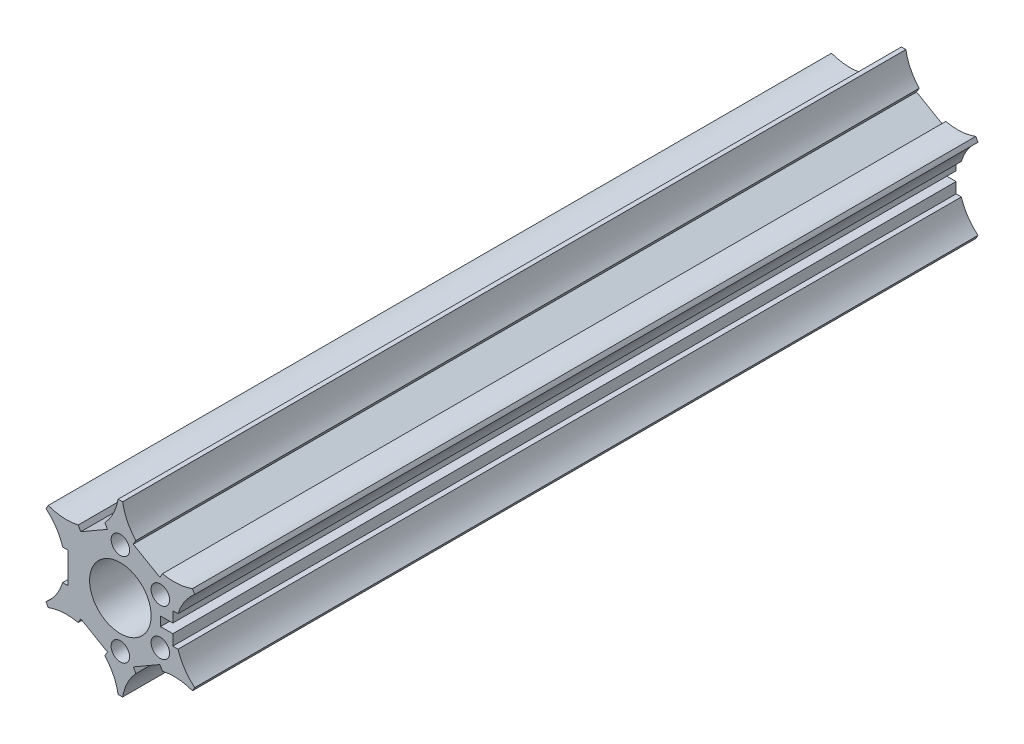
from build123d import *

# Parameters (mm, degrees)
BOSS_EXTRU_1_DEPTH      = 254.666666667
ESQUISSE4_R             = 51.382798763
ESQUISSE4_R_2           = 27.5
ENL_V_MAT_EXTRU_1_DEPTH = 265.098930571
ESQUISSE5_R             = 10
ESQUISSE5_R_2           = 3
ESQUISSE5_W             = 1.7
ESQUISSE5_H             = 10
ENL_V_MAT_EXTRU_2_DEPTH = 258.285428534


with BuildPart() as part:
    # Esquisse1 → Boss.-Extru.1 (new body)
    with BuildSketch(Plane.XY):
        with BuildLine():
            Line((-17.5, -48.310889132), (-17.5, -47.310889132))
            ThreePointArc((-17.5, -47.310889132), (-9, -15.588457268), (-32.222431864, -38.810889132))
            Line((-32.222431864, -38.810889132), (-33.088457268, -39.310889132))
            ThreePointArc((-33.088457268, -39.310889132), (-35.314540075, -27.733649929), (-29.89862988, -17.26198201))
            ThreePointArc((-29.89862988, -17.26198201), (-41.675315415, -16.716463864), (-50.588457268, -9))
            Line((-50.588457268, -9), (-49.722431864, -8.5))
            ThreePointArc((-49.722431864, -8.5), (-18, 0), (-49.722431864, 8.5))
            Line((-49.722431864, 8.5), (-50.588457268, 9))
            ThreePointArc((-50.588457268, 9), (-41.675315415, 16.716463864), (-29.89862988, 17.26198201))
            ThreePointArc((-29.89862988, 17.26198201), (-35.314540075, 27.733649929), (-33.088457268, 39.310889132))
            Line((-33.088457268, 39.310889132), (-32.222431864, 38.810889132))
            ThreePointArc((-32.222431864, 38.810889132), (-9, 15.588457268), (-17.5, 47.310889132))
            Line((-17.5, 47.310889132), (-17.5, 48.310889132))
            ThreePointArc((-17.5, 48.310889132), (-6.36077534, 44.450113792), (0, 34.523964019))
            ThreePointArc((0, 34.523964019), (6.36077534, 44.450113792), (17.5, 48.310889132))
            Line((17.5, 48.310889132), (17.5, 47.310889132))
            ThreePointArc((17.5, 47.310889132), (9, 15.588457268), (32.222431864, 38.810889132))
            Line((32.222431864, 38.810889132), (33.088457268, 39.310889132))
            ThreePointArc((33.088457268, 39.310889132), (35.314540075, 27.733649929), (29.89862988, 17.26198201))
            ThreePointArc((29.89862988, 17.26198201), (41.675315415, 16.716463864), (50.588457268, 9))
            Line((50.588457268, 9), (49.722431864, 8.5))
            ThreePointArc((49.722431864, 8.5), (18, 0), (49.722431864, -8.5))
            Line((49.722431864, -8.5), (50.588457268, -9))
            ThreePointArc((50.588457268, -9), (41.675315415, -16.716463864), (29.89862988, -17.26198201))
            ThreePointArc((29.89862988, -17.26198201), (35.314540075, -27.733649929), (33.088457268, -39.310889132))
            Line((33.088457268, -39.310889132), (32.222431864, -38.810889132))
            ThreePointArc((32.222431864, -38.810889132), (9, -15.588457268), (17.5, -47.310889132))
            Line((17.5, -47.310889132), (17.5, -48.310889132))
            ThreePointArc((17.5, -48.310889132), (6.36077534, -44.450113792), (0, -34.523964019))
            ThreePointArc((0, -34.523964019), (-6.36077534, -44.450113792), (-17.5, -48.310889132))
        make_face()
    extrude(amount=BOSS_EXTRU_1_DEPTH)

    # Esquisse4 → Enlèv. mat.-Extru.1 (cut, through all)
    with BuildSketch(Plane.XY.offset(254.666666667)):
        Circle(ESQUISSE4_R)
        Circle(ESQUISSE4_R_2, mode=Mode.SUBTRACT)
    extrude(amount=-ENL_V_MAT_EXTRU_1_DEPTH, mode=Mode.SUBTRACT)

    # Esquisse5 → Enlèv. mat.-Extru.2 (cut, through all)
    with BuildSketch(Plane.XY.offset(254.666666667)):
        Circle(ESQUISSE5_R)
        with Locations((0, 15)):
            Circle(ESQUISSE5_R_2)
        with Locations((12.990381057, 7.5)):
            Circle(ESQUISSE5_R_2)
        with Locations((12.990381057, -7.5)):
            Circle(ESQUISSE5_R_2)
        with Locations((0, -15)):
            Circle(ESQUISSE5_R_2)
        Polygon((13.706088614, -13.739641853), (5.045834576, -18.739641853), (4.195834576, -17.267398667), (12.856088614, -12.267398667), align=None)
        Polygon((17.051923191, 5), (18.751923191, 5), (18.751923191, -5), (17.051923191, -5), (17.051923191, -1.5), (13.051923191, -1.5), (13.051923191, 1.5), (17.051923191, 1.5), align=None)
        Polygon((-5.045834576, -18.739641853), (-13.706088614, -13.739641853), (-12.856088614, -12.267398667), (-4.195834576, -17.267398667), align=None)
        with Locations((-17.901923191, 0)):
            Rectangle(ESQUISSE5_W, ESQUISSE5_H)
        Polygon((-13.706088614, 13.739641853), (-5.045834576, 18.739641853), (-4.195834576, 17.267398667), (-12.856088614, 12.267398667), align=None)
        Polygon((5.045834576, 18.739641853), (13.706088614, 13.739641853), (12.856088614, 12.267398667), (4.195834576, 17.267398667), align=None)
    extrude(amount=-ENL_V_MAT_EXTRU_2_DEPTH, mode=Mode.SUBTRACT)


solid = part.part
